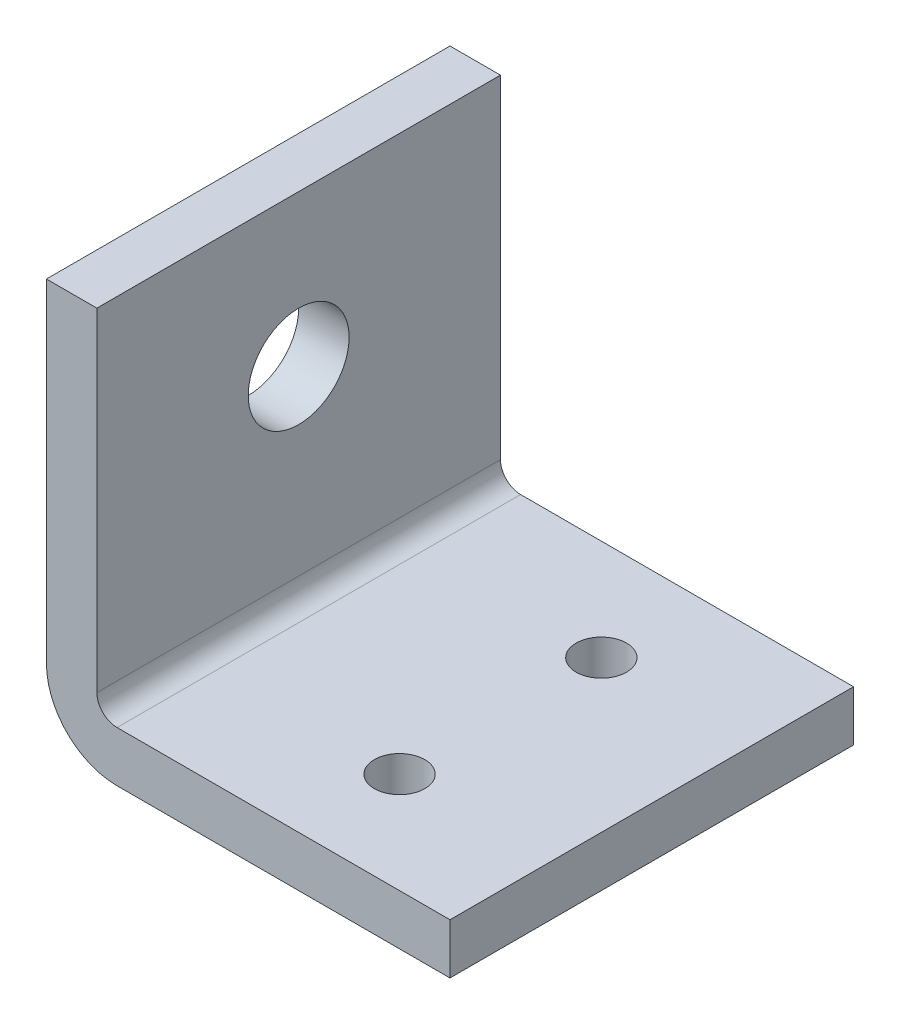
from build123d import *

# Parameters (mm, degrees)
SKETCH1_W               = 40
SKETCH1_H               = 40
BOSS_EXTRUDE1_DEPTH     = 20
CUT_EXTRUDE1_DEPTH      = 49.989794856
CUT_EXTRUDE1_DEPTH_BACK = 49.989794856
SKETCH2_W               = 35
SKETCH2_H               = 35
FILLET1_R               = 2
FILLET2_R               = 7
HOLE1_D                 = 10
HOLE3_D                 = 5


with BuildPart() as part:
    # Sketch1 → Boss-Extrude1 (new, symmetric)
    with BuildSketch(Plane.XY):
        Rectangle(SKETCH1_W, SKETCH1_H)
    extrude(amount=BOSS_EXTRUDE1_DEPTH, both=True)

    # Sketch2 → Cut-Extrude1 (cut, two sides: drawn at the far end of the back side and taken through both)
    with BuildSketch(Plane.XY.offset(20).offset(-CUT_EXTRUDE1_DEPTH_BACK)):
        with Locations((2.5, 2.5)):
            Rectangle(SKETCH2_W, SKETCH2_H)
    extrude(amount=CUT_EXTRUDE1_DEPTH + CUT_EXTRUDE1_DEPTH_BACK, mode=Mode.SUBTRACT)

    # Fillet1
    fillet1_edges = [part.edges().sort_by_distance(p)[0] for p in [
        (-15, -15, 0),
    ]]
    fillet(fillet1_edges, radius=FILLET1_R)

    # Fillet2
    fillet2_edges = [part.edges().sort_by_distance(p)[0] for p in [
        (-20, -20, 0),
    ]]
    fillet(fillet2_edges, radius=FILLET2_R)

    # Hole1 (through all)
    with Locations(Plane(origin=(-15, 0, 0), x_dir=(0, 0, -1), z_dir=(1, 0, 0))):
        with Locations((0, 5)):
            Hole(HOLE1_D / 2)

    # Hole3 (through all)
    with Locations(Plane(origin=(0, -15, 0), x_dir=(1, 0, 0), z_dir=(0, 1, 0))):
        with Locations((5, -10)):
            hole3 = Hole(HOLE3_D / 2)

    # Mirror1: Hole3 across plane
    add(hole3.mirror(Plane.XY), mode=Mode.SUBTRACT)


solid = part.part
